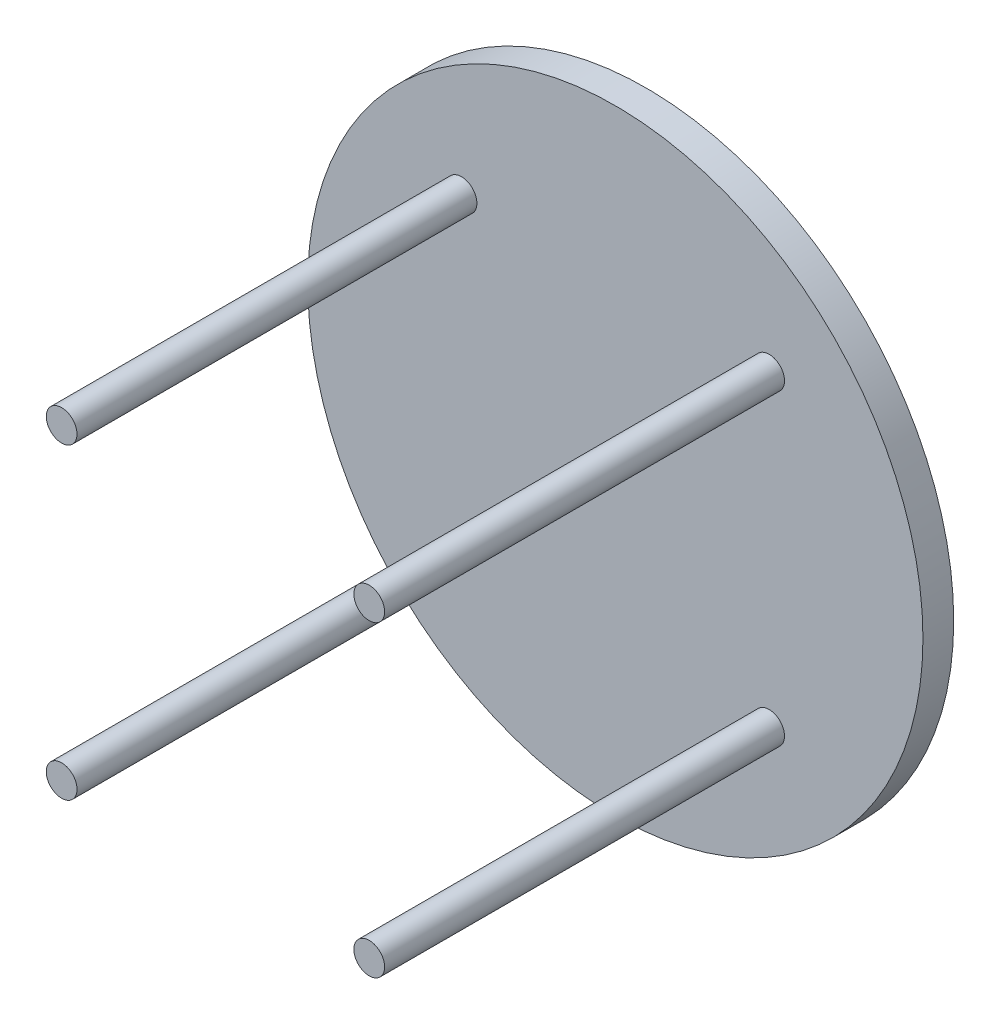
from build123d import *

# Parameters (mm, degrees)
SKETCH_1_R      = 500
EXTRUDE_1_DEPTH = 50
SKETCH_2_R      = 25
EXTRUDE_2_DEPTH = 700
SKETCH_3_R      = 25
EXTRUDE_3_DEPTH = 700
SKETCH_4_R      = 25
EXTRUDE_4_DEPTH = 700
SKETCH_5_R      = 25
EXTRUDE_5_DEPTH = 700


with BuildPart() as part:
    # 草图1 → 凸台-拉伸1 (new body)
    with BuildSketch(Plane.XY):
        Circle(SKETCH_1_R)
    extrude(amount=EXTRUDE_1_DEPTH)

    # 草图2 → 凸台-拉伸2 (add)
    with BuildSketch(Plane.XY):
        with Locations((250, 250)):
            Circle(SKETCH_2_R)
    extrude(amount=EXTRUDE_2_DEPTH)

    # 草图3 → 凸台-拉伸3 (add)
    with BuildSketch(Plane.XY):
        with Locations((-250, 250)):
            Circle(SKETCH_3_R)
    extrude(amount=EXTRUDE_3_DEPTH)

    # 草图4 → 凸台-拉伸4 (add)
    with BuildSketch(Plane.XY):
        with Locations((250, -250)):
            Circle(SKETCH_4_R)
    extrude(amount=EXTRUDE_4_DEPTH)

    # 草图5 → 凸台-拉伸5 (add)
    with BuildSketch(Plane.XY):
        with Locations((-250, -250)):
            Circle(SKETCH_5_R)
    extrude(amount=EXTRUDE_5_DEPTH)


solid = part.part
